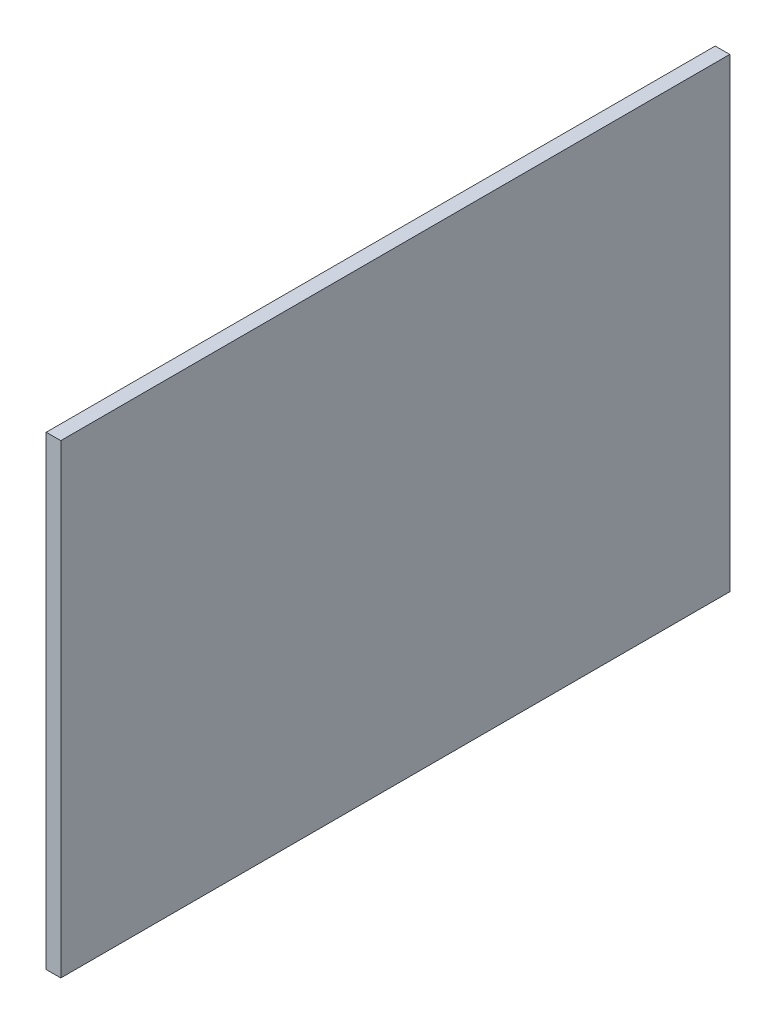
from build123d import *

# Parameters (mm, degrees)
SKETCH1_W           = 146.05
SKETCH1_H           = 101.6
BOSS_EXTRUDE1_DEPTH = 3.175


with BuildPart() as part:
    # Sketch1 → Boss-Extrude1 (new body)
    with BuildSketch(Plane(origin=(0, 0, 0), x_dir=(0, 0, -1), z_dir=(1, 0, 0))):
        with Locations((-1.916255068, 7.157780853)):
            Rectangle(SKETCH1_W, SKETCH1_H)
    extrude(amount=BOSS_EXTRUDE1_DEPTH)


solid = part.part
